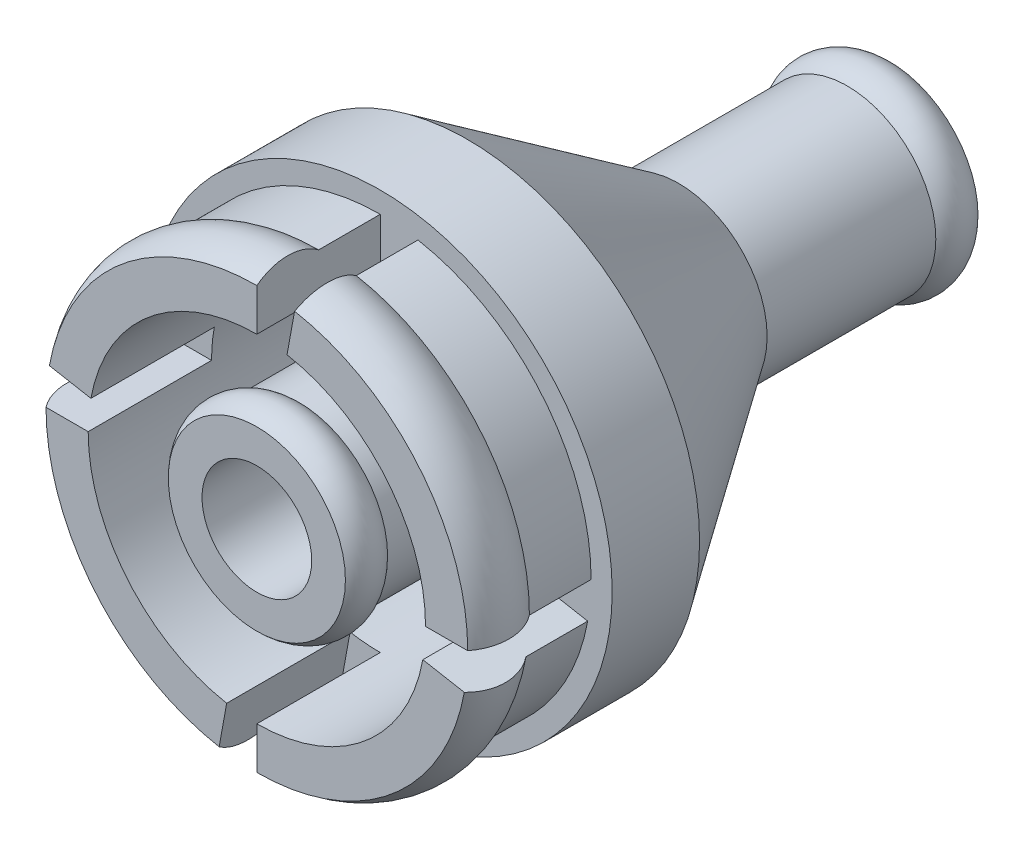
from build123d import *

# Parameters (mm, degrees)
SKETCH1_R           = 5.5
SKETCH1_R_2         = 1.3
BOSS_EXTRUDE1_DEPTH = 15
CUT_EXTRUDE1_START  = -2.925993492
CUT_EXTRUDE1_DEPTH  = 2.925993492


with BuildPart() as part:
    # Sketch1 → Boss-Extrude1 (new body)
    with BuildSketch(Plane.XY):
        Circle(SKETCH1_R)
        Circle(SKETCH1_R_2, mode=Mode.SUBTRACT)
    extrude(amount=BOSS_EXTRUDE1_DEPTH)

    # Sketch3 → Cut-Revolve1 (revolve, cut)
    with BuildSketch(Plane(origin=(0, 0, 0), x_dir=(1, 0, 0), z_dir=(0, 1, 0)), mode=Mode.PRIVATE) as cut_revolve1_sk:
        with BuildLine():
            Line((-2.1, -5), (-5.5, -10.001935684))
            Line((-5.5, -10.001935684), (-5.5, 0))
            Line((-5.5, 0), (-2.1, 0))
            ThreePointArc((-2.1, 0), (-2.307106781, -0.5), (-2.1, -1))
            Line((-2.1, -1), (-2.1, -5))
        make_face()
        with BuildLine():
            Line((-2.1, -15), (-4, -15))
            Line((-4, -15), (-4, -10))
            Line((-4, -10), (-2.1, -10))
            Line((-2.1, -10), (-2.1, -14))
            ThreePointArc((-2.1, -14), (-2.307106781, -14.5), (-2.1, -15))
        make_face()
        with BuildLine():
            Line((-5.5, -15), (-5, -15))
            ThreePointArc((-5, -15), (-5.248310238, -14.268501627), (-5, -13.537003254))
            Line((-5, -13.537003254), (-5, -12.074006508))
            Line((-5, -12.074006508), (-5.5, -12.074006508))
            Line((-5.5, -12.074006508), (-5.5, -15))
        make_face()
    revolve(cut_revolve1_sk.sketch.rotate(Axis((0, 0, 15), (0, 0, -1)), 180), axis=Axis((0, 0, 15), (0, 0, -1)), mode=Mode.SUBTRACT)

    # Sketch4 → Cut-Extrude1 (cut)
    with BuildSketch(Plane.XY.offset(15).offset(CUT_EXTRUDE1_START)):
        with BuildLine():
            Line((0, -4), (0, -5.5))
            ThreePointArc((0, -5.5), (-0.493930774, -5.477776227), (-0.98386991, -5.411284506))
            Line((-0.98386991, -5.411284506), (-0.715541753, -3.93547964))
            ThreePointArc((-0.715541753, -3.93547964), (-0.359222381, -3.983837256), (0, -4))
        make_face()
        with BuildLine():
            Line((-4, 0), (-5.5, 0))
            ThreePointArc((-5.5, 0), (-5.477776227, 0.493930774), (-5.411284506, 0.98386991))
            Line((-5.411284506, 0.98386991), (-3.93547964, 0.715541753))
            ThreePointArc((-3.93547964, 0.715541753), (-3.983837256, 0.359222381), (-4, 0))
        make_face()
        with BuildLine():
            Line((0, 4), (0, 5.5))
            ThreePointArc((0, 5.5), (0.493930774, 5.477776227), (0.98386991, 5.411284506))
            Line((0.98386991, 5.411284506), (0.715541753, 3.93547964))
            ThreePointArc((0.715541753, 3.93547964), (0.359222381, 3.983837256), (0, 4))
        make_face()
        with BuildLine():
            Line((4, 0), (5.5, 0))
            ThreePointArc((5.5, 0), (5.477776227, -0.493930774), (5.411284506, -0.98386991))
            Line((5.411284506, -0.98386991), (3.93547964, -0.715541753))
            ThreePointArc((3.93547964, -0.715541753), (3.983837256, -0.359222381), (4, 0))
        make_face()
    extrude(amount=CUT_EXTRUDE1_DEPTH, mode=Mode.SUBTRACT)


solid = part.part
